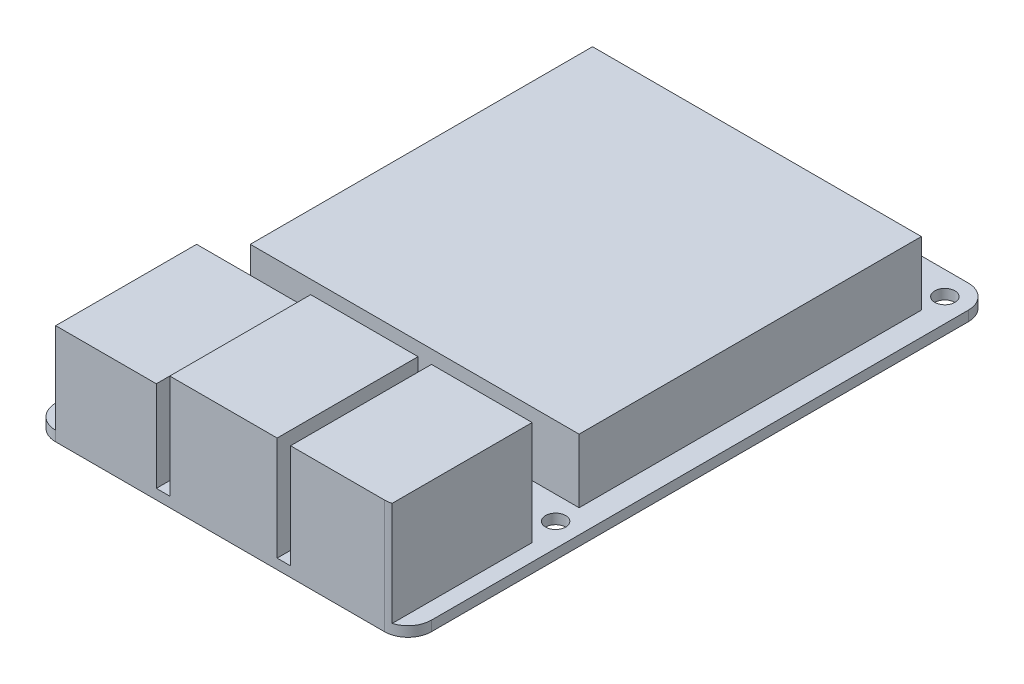
from build123d import *

# Parameters (mm, degrees)
SKETCH_1_R      = 1.5
EXTRUDE_1_DEPTH = 1.5
EXTRUDE_2_DEPTH = 15.5
SKETCH_3_W      = 49
SKETCH_3_H      = 51
EXTRUDE_3_DEPTH = 9.5
SKETCH_4_W      = 15
SKETCH_4_H      = 21
EXTRUDE_4_DEPTH = 13.5


with BuildPart() as part:
    # Эскиз1 → Бобышка-Вытянуть1 (new body)
    with BuildSketch(Plane(origin=(0, 0, 0), x_dir=(1, 0, 0), z_dir=(0, 1, 0))):
        with BuildLine():
            Line((3.5, 0), (52.5, 0))
            ThreePointArc((52.5, 0), (54.974873734, 1.025126266), (56, 3.5))
            Line((56, 3.5), (56, 83.5))
            ThreePointArc((56, 83.5), (54.974873734, 85.974873734), (52.5, 87))
            Line((52.5, 87), (3.5, 87))
            ThreePointArc((3.5, 87), (1.025126266, 85.974873734), (0, 83.5))
            Line((0, 83.5), (0, 3.5))
            ThreePointArc((0, 3.5), (1.025126266, 1.025126266), (3.5, 0))
        make_face()
        with Locations(Location((3.5, 83.5, 0), (0, 0, 270))):
            Circle(SKETCH_1_R, mode=Mode.SUBTRACT)
        with Locations(Location((52.5, 83.5, 0), (0, 0, 270))):
            Circle(SKETCH_1_R, mode=Mode.SUBTRACT)
        with Locations(Location((52.5, 25.5, 0), (0, 0, 270))):
            Circle(SKETCH_1_R, mode=Mode.SUBTRACT)
        with Locations(Location((3.5, 25.5, 0), (0, 0, 270))):
            Circle(SKETCH_1_R, mode=Mode.SUBTRACT)
    extrude(amount=EXTRUDE_1_DEPTH)

    # Эскиз2 → Бобышка-Вытянуть2 (add)
    with BuildSketch(Plane(origin=(0, 1.5, 0), x_dir=(1, 0, 0), z_dir=(0, 1, 0))):
        Polygon((20.5, 0), (28, 0), (36.5, 0), (36.5, 21), (20.5, 21), align=None)
        with BuildLine():
            Line((38.5, 21), (38.5, 0))
            Line((38.5, 0), (52.5, 0))
            ThreePointArc((52.5, 0), (53.005293538, 0.036666571), (53.5, 0.145898034))
            Line((53.5, 0.145898034), (53.5, 21))
            Line((53.5, 21), (38.5, 21))
        make_face()
    extrude(amount=EXTRUDE_2_DEPTH)

    # Эскиз3 → Бобышка-Вытянуть3 (add)
    with BuildSketch(Plane(origin=(0, 1.5, 0), x_dir=(1, 0, 0), z_dir=(0, 1, 0))):
        with Locations((28, 54.5)):
            Rectangle(SKETCH_3_W, SKETCH_3_H)
    extrude(amount=EXTRUDE_3_DEPTH)

    # Эскиз4 → Бобышка-Вытянуть4 (add)
    with BuildSketch(Plane(origin=(0, 1.5, 0), x_dir=(1, 0, 0), z_dir=(0, 1, 0))):
        with Locations((11, 10.5)):
            Rectangle(SKETCH_4_W, SKETCH_4_H)
    extrude(amount=EXTRUDE_4_DEPTH)


solid = part.part
